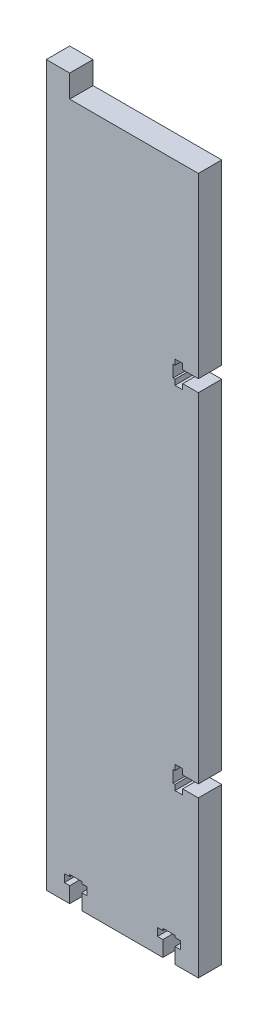
from build123d import *

# Parameters (mm, degrees)
SZKIC1_W                    = 39
SZKIC1_H                    = 178.7
DODANIE_WYCI_GNI_CIE1_DEPTH = 6
WYTNIJ_WYCI_GNI_CIE1_DEPTH  = 208.642171135
WYTNIJ_WYCI_GNI_CIE2_DEPTH  = 208.642171135
SZYK_LINIOWY1_COUNT         = 2
SZYK_LINIOWY1_PITCH         = 90
SZYK_LINIOWY2_COUNT         = 2
SZYK_LINIOWY2_PITCH         = 23.9
SZKIC4_W                    = 6
SZKIC4_H                    = 6
DODANIE_WYCI_GNI_CIE2_DEPTH = 5.8


with BuildPart() as part:
    # Szkic1 → Dodanie-wyciągnięcie1 (new body)
    with BuildSketch(Plane.XY):
        with Locations((-35.991181586, -110.65)):
            Rectangle(SZKIC1_W, SZKIC1_H)
    extrude(amount=-DODANIE_WYCI_GNI_CIE1_DEPTH)

    # Szkic2 → Wytnij-wyciągnięcie1 (cut, through all)
    with BuildSketch(Plane(origin=(0, 0, -6), x_dir=(-1, 0, 0), z_dir=(0, 0, -1))):
        Polygon((16.491181586, -160), (16.491181586, -156.9), (20.491181586, -156.9), (20.491181586, -155.525), (22.491181586, -155.525), (22.491181586, -156.9), (22.991181586, -156.9), (22.991181586, -160), (22.491181586, -160), (22.491181586, -161.375), (20.491181586, -161.375), (20.491181586, -160), align=None)
    wytnij_wyci_gni_cie1 = extrude(amount=-WYTNIJ_WYCI_GNI_CIE1_DEPTH, mode=Mode.SUBTRACT)

    # Szkic3 → Wytnij-wyciągnięcie2 (cut, through all)
    with BuildSketch(Plane(origin=(0, 0, -6), x_dir=(-1, 0, 0), z_dir=(0, 0, -1))):
        Polygon((49.491181586, -200), (49.491181586, -196), (50.866181586, -196), (50.866181586, -194), (49.491181586, -194), (49.491181586, -193.5), (46.391181586, -193.5), (46.391181586, -194), (45.016181586, -194), (45.016181586, -196), (46.391181586, -196), (46.391181586, -200), align=None)
    wytnij_wyci_gni_cie2 = extrude(amount=-WYTNIJ_WYCI_GNI_CIE2_DEPTH, mode=Mode.SUBTRACT)

    # Szyk liniowy1: Wytnij-wyciągnięcie1 ×2
    with Locations(*[(0, i * SZYK_LINIOWY1_PITCH, 0) for i in range(1, SZYK_LINIOWY1_COUNT)]):
        add(wytnij_wyci_gni_cie1, mode=Mode.SUBTRACT)

    # Szyk liniowy2: Wytnij-wyciągnięcie2 ×2
    with Locations(*[(i * SZYK_LINIOWY2_PITCH, 0, 0) for i in range(1, SZYK_LINIOWY2_COUNT)]):
        add(wytnij_wyci_gni_cie2, mode=Mode.SUBTRACT)

    # Szkic4 → Dodanie-wyciągnięcie2 (add)
    with BuildSketch(Plane(origin=(0, -21.3, 0), x_dir=(1, 0, 0), z_dir=(0, 1, 0))):
        with Locations((-52.491181586, 3)):
            Rectangle(SZKIC4_W, SZKIC4_H)
    extrude(amount=DODANIE_WYCI_GNI_CIE2_DEPTH)


solid = part.part
